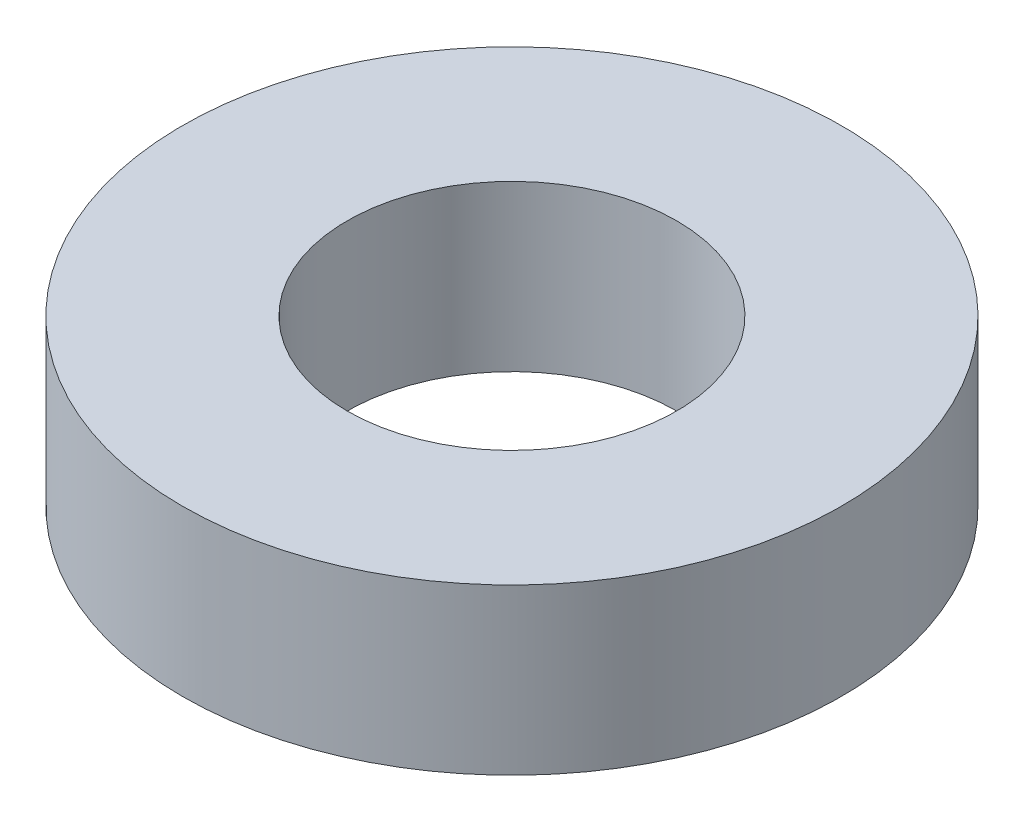
from build123d import *

# Parameters (mm, degrees)
SKETCH_1_R      = 20
SKETCH_1_R_2    = 10
EXTRUDE_1_DEPTH = 10


with BuildPart() as part:
    # 草图1 → 凸台-拉伸1 (new body)
    with BuildSketch(Plane(origin=(0, 0, 0), x_dir=(1, 0, 0), z_dir=(0, 1, 0))):
        with Locations(Location((0, 0, 0), (0, 0, 270))):
            Circle(SKETCH_1_R)
        with Locations(Location((0, 0, 0), (0, 0, 270))):
            Circle(SKETCH_1_R_2, mode=Mode.SUBTRACT)
    extrude(amount=EXTRUDE_1_DEPTH)


solid = part.part
